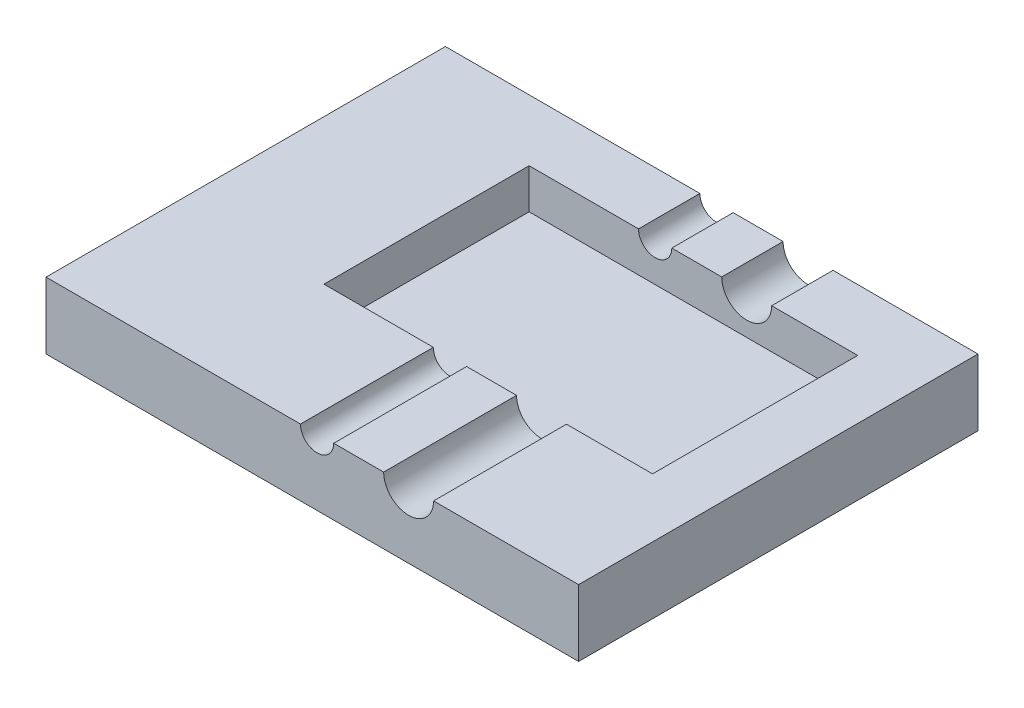
from build123d import *

# Parameters (mm, degrees)
SKETCH1_W           = 101.6
SKETCH1_H           = 76.2
BOSS_EXTRUDE1_DEPTH = 12.7
SKETCH4_W           = 62.685063192
SKETCH4_H           = 39.138657103
CUT_EXTRUDE2_DEPTH  = 7.62
SKETCH5_R           = 3.175
SKETCH5_R_2         = 4.7625
CUT_EXTRUDE3_DEPTH  = 93.457395594


with BuildPart() as part:
    # Sketch1 → Boss-Extrude1 (new body)
    with BuildSketch(Plane(origin=(0, 0, 0), x_dir=(1, 0, 0), z_dir=(0, 1, 0))):
        with Locations((0, 30.062025316)):
            Rectangle(SKETCH1_W, SKETCH1_H)
    extrude(amount=BOSS_EXTRUDE1_DEPTH)

    # Sketch4 → Cut-Extrude2 (cut)
    with BuildSketch(Plane(origin=(0, 12.7, 0), x_dir=(1, 0, 0), z_dir=(0, 1, 0))):
        with Locations((8.217537696, 36.883635135)):
            Rectangle(SKETCH4_W, SKETCH4_H)
    extrude(amount=-CUT_EXTRUDE2_DEPTH, mode=Mode.SUBTRACT)

    # Sketch5 → Cut-Extrude3 (cut, through all)
    with BuildSketch(Plane.XY.offset(8.037974684)):
        with Locations((0.917080185, 12.7)):
            Circle(SKETCH5_R)
        with Locations((18.379580185, 12.7)):
            Circle(SKETCH5_R_2)
    extrude(amount=-CUT_EXTRUDE3_DEPTH, mode=Mode.SUBTRACT)


solid = part.part
